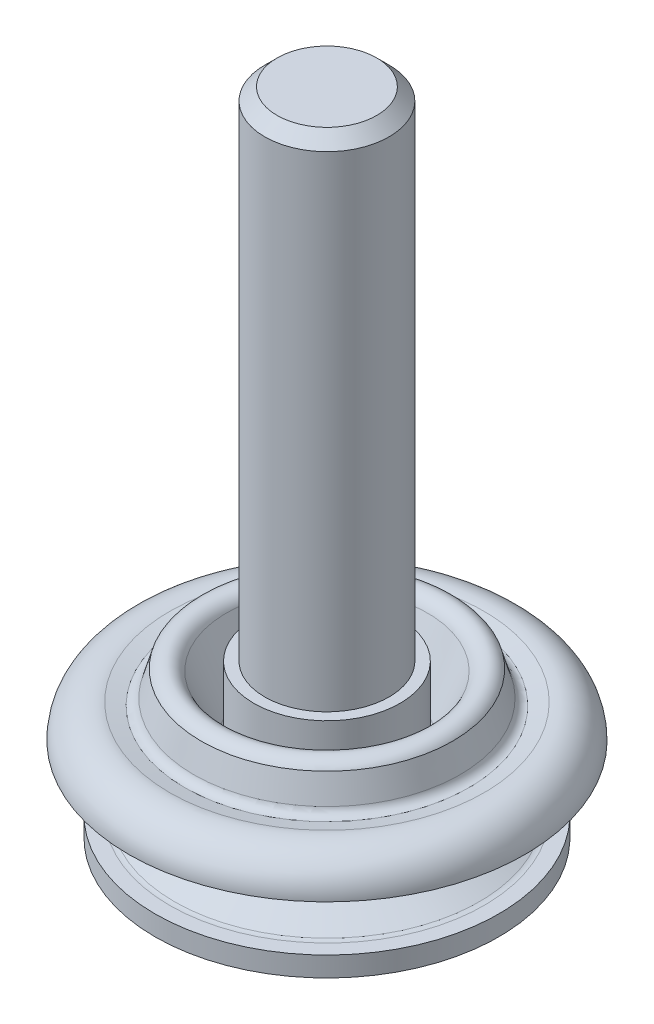
from build123d import *


with BuildPart() as part:
    # Sketch1 → Revolve1 (revolve)
    with BuildSketch(Plane(origin=(0, 0, 0.319361058), x_dir=(-1, 0, 0), z_dir=(0, 0, -1)), mode=Mode.PRIVATE) as revolve1_sk:
        with BuildLine():
            Line((5.219920394, 23.307110223), (10.880532644, 23.307110223))
            Line((10.880532644, 23.307110223), (10.880532644, 70.23324387))
            Line((10.880532644, 70.23324387), (7.064182097, 70.23324387))
            Line((7.064182097, 70.23324387), (6.118031843, 69.287093616))
            Line((6.118031843, 69.287093616), (6.118031843, 32.1332426))
            Line((6.118031843, 32.1332426), (5.278459227, 32.1332426))
            Line((5.278459227, 32.1332426), (5.278459227, 27.020461867))
            ThreePointArc((5.278459227, 27.020461867), (5.139142192, 27.062078487), (5.045478081, 27.173290957))
            Line((5.045478081, 27.173290957), (3.178035559, 31.473758126))
            ThreePointArc((3.178035559, 31.473758126), (2.263412274, 32.129803953), (1.252618834, 31.634598436))
            Line((1.252618834, 31.634598436), (0.688664711, 29.689081353))
            ThreePointArc((0.688664711, 29.689081353), (0.43146251, 29.316580636), (0.002081826, 29.173255886))
            Line((0.002081826, 29.173255886), (-1.157069426, 29.421640272))
            ThreePointArc((-1.157069426, 29.421640272), (-3.328688696, 28.903121287), (-4.29070663, 26.888347432))
            Line((-4.29070663, 26.888347432), (-2.766706598, 26.888347432))
            ThreePointArc((-2.766706598, 26.888347432), (-1.699906598, 25.821547432), (-0.633106598, 26.888347432))
            Line((-0.633106598, 26.888347432), (0.002083353, 26.888347432))
            ThreePointArc((0.002083353, 26.888347432), (0.572796555, 27.052128464), (0.969809906, 27.49362386))
            Line((0.969809906, 27.49362386), (2.172120169, 29.964068738))
            Line((2.172120169, 29.964068738), (3.536175099, 26.452739972))
            ThreePointArc((3.536175099, 26.452739972), (3.838075114, 26.015391646), (4.342157, 25.847110246))
            Line((4.342157, 25.847110246), (4.102285026, 25.847110246))
            Line((4.102285026, 25.847110246), (4.056739711, 24.683572406))
            ThreePointArc((4.056739711, 24.683572406), (3.952260249, 24.358712352), (3.694708516, 24.134843825))
            Line((3.694708516, 24.134843825), (-0.789659198, 22.004466497))
            ThreePointArc((-0.789659198, 22.004466497), (-0.970787361, 21.958248999), (-1.157071252, 21.942699715))
            Line((-1.157071252, 21.942699715), (-2.280702576, 21.942699715))
            Line((-2.280702576, 21.942699715), (-2.280702576, 20.418699828))
            Line((-2.280702576, 20.418699828), (-0.862409405, 20.418699828))
            ThreePointArc((-0.862409405, 20.418699828), (-0.583087187, 20.44979745), (-0.317444113, 20.541567385))
            Line((-0.317444113, 20.541567385), (4.348666866, 22.758284767))
            ThreePointArc((4.348666866, 22.758284767), (5.131403916, 23.38932259), (5.543473661, 24.306429207))
            ThreePointArc((5.543473661, 24.306429207), (5.747223761, 24.625152196), (6.114757106, 24.714693734))
            Line((6.114757106, 24.714693734), (5.219920394, 23.307110223))
        make_face()
    revolve(revolve1_sk.sketch.rotate(Axis((-10.880532644, 20.418699693, 0.319361058), (0, 1, 0)), 270), axis=Axis((-10.880532644, 20.418699693, 0.319361058), (0, 1, 0)))


solid = part.part
